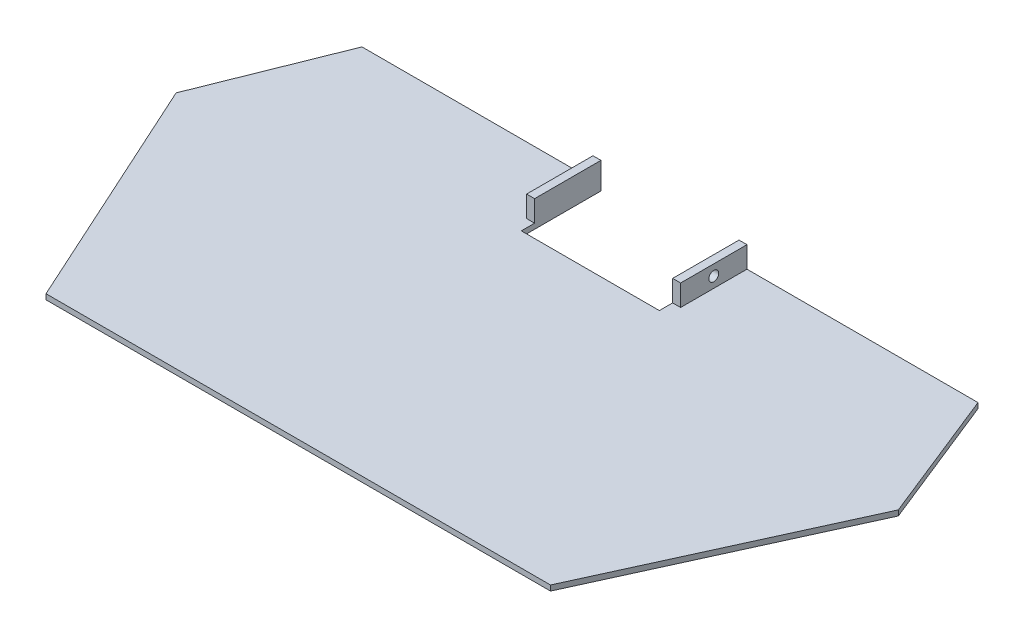
from build123d import *

# Parameters (mm, degrees)
EXTRUDE_1_DEPTH     = 2
SKETCH_2_W          = 3
SKETCH_2_H          = 25
EXTRUDE_2_DEPTH     = 8
SKETCH_3_R          = 1.85
CUT_EXTRUDE_1_DEPTH = 8


with BuildPart() as part:
    # 草图1 → 凸台-拉伸1 (new body)
    with BuildSketch(Plane(origin=(0, 0, 0), x_dir=(1, 0, 0), z_dir=(0, 1, 0))):
        Polygon((26, 30), (-26, 30), (-26, 60), (-116, 60), (-136, 10), (-95, -80), (95, -80), (136, 10), (116, 60), (26, 60), align=None)
    extrude(amount=EXTRUDE_1_DEPTH)

    # 草图2 → 凸台-拉伸2 (add)
    with BuildSketch(Plane(origin=(0, 2, 0), x_dir=(1, 0, 0), z_dir=(0, 1, 0))):
        with Locations((27.5, 47.5)):
            Rectangle(SKETCH_2_W, SKETCH_2_H)
        with Locations((-27.5, 47.5)):
            Rectangle(SKETCH_2_W, SKETCH_2_H)
    extrude(amount=EXTRUDE_2_DEPTH)

    # 草图3 → 切除-拉伸1 (cut)
    with BuildSketch(Plane.ZY.offset(-26)):
        with Locations((-47.5, 6)):
            Circle(SKETCH_3_R)
    extrude(amount=-CUT_EXTRUDE_1_DEPTH, mode=Mode.SUBTRACT)


solid = part.part
